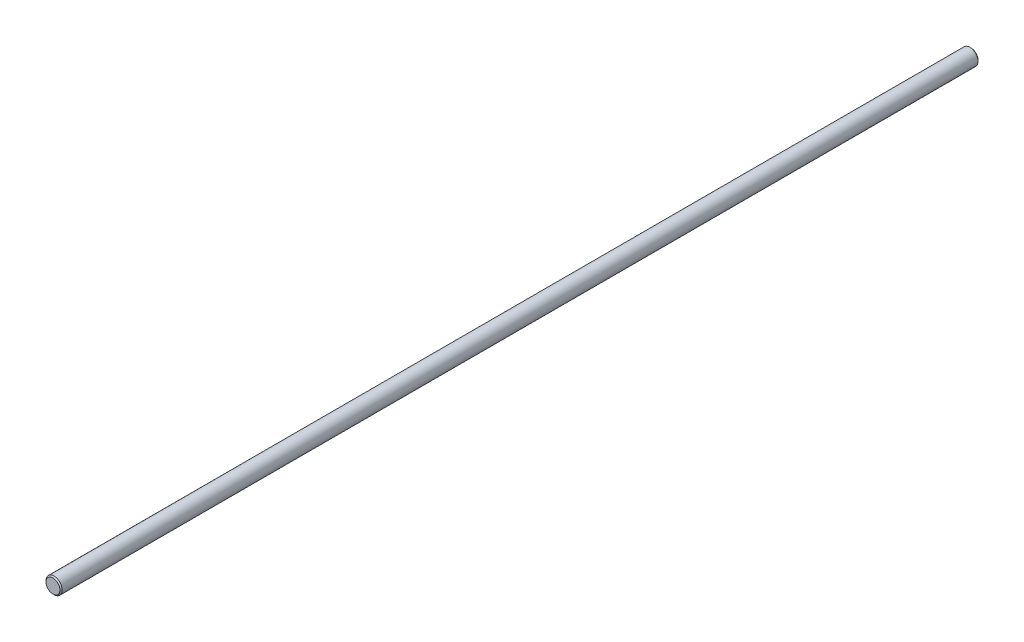
from build123d import *

# Parameters (mm, degrees)
BOSS_EXTRUDE1_DEPTH      = 190
BOSS_EXTRUDE1_DEPTH_BACK = 150
SKETCH3_R                = 3
CHAMFER1_SIZE            = 0.42


with BuildPart() as part:
    # Sketch3 → Boss-Extrude1 (new, two sides: drawn at the far end of the back side and taken through both)
    with BuildSketch(Plane.XY.offset(-BOSS_EXTRUDE1_DEPTH_BACK)):
        Circle(SKETCH3_R)
    extrude(amount=BOSS_EXTRUDE1_DEPTH + BOSS_EXTRUDE1_DEPTH_BACK)

    # Chamfer1
    chamfer1_edges = [part.edges().sort_by_distance(p)[0] for p in [
        (-3, 0, -150),
        (-3, 0, 190),
    ]]
    chamfer(chamfer1_edges, length=CHAMFER1_SIZE)


solid = part.part
